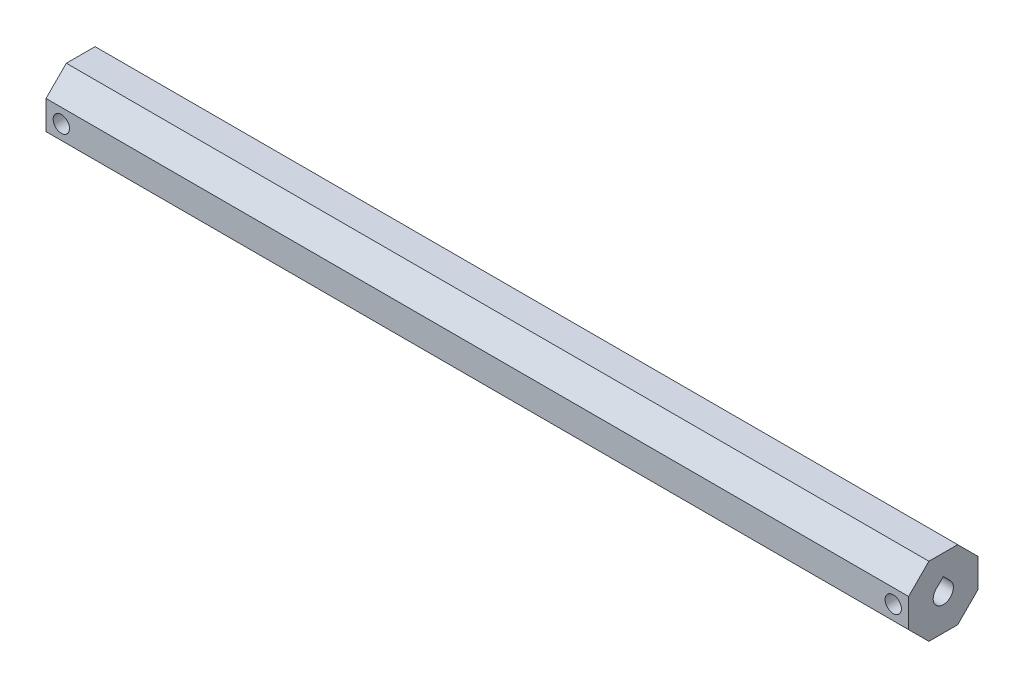
from build123d import *

# Parameters (mm, degrees)
EXTRUDE_1_DEPTH     = 225
CUT_EXTRUDE_1_DEPTH = 226.363982288
SKETCH_4_R          = 2.13
CUT_EXTRUDE_2_DEPTH = 8.5


with BuildPart() as part:
    # 草图1 → 凸台-拉伸1 (new body)
    with BuildSketch(Plane(origin=(0, 0, 0), x_dir=(0, 0, -1), z_dir=(1, 0, 0))):
        Polygon((9.053300859, -3.75), (9.053300859, 3.75), (3.75, 9.053300859), (-3.75, 9.053300859), (-9.053300859, 3.75), (-9.053300859, -3.75), (-3.75, -9.053300859), (3.75, -9.053300859), align=None)
    extrude(amount=EXTRUDE_1_DEPTH)

    # 草图2 → 切除-拉伸1 (cut, through all)
    with BuildSketch(Plane(origin=(225, 0, 0), x_dir=(0, 0, -1), z_dir=(1, 0, 0))):
        with BuildLine():
            Line((-1.859690835, 1.859690835), (0, 3.719381669))
            Line((0, 3.719381669), (1.859690835, 1.859690835))
            ThreePointArc((1.859690835, 1.859690835), (0, -2.63), (-1.859690835, 1.859690835))
        make_face()
    extrude(amount=-CUT_EXTRUDE_1_DEPTH, mode=Mode.SUBTRACT)

    # 草图4 → 切除-拉伸2 (cut)
    with BuildSketch(Plane(origin=(0, 0, 9.053300859), x_dir=(1, 0, 0), z_dir=(0, 0, -1))):
        with Locations((4, 0)):
            Circle(SKETCH_4_R)
        with Locations((221, 0)):
            Circle(SKETCH_4_R)
    extrude(amount=CUT_EXTRUDE_2_DEPTH, mode=Mode.SUBTRACT)


solid = part.part
